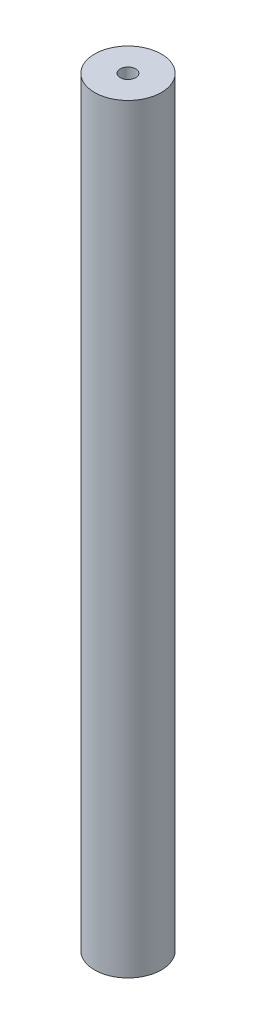
from build123d import *

# Parameters (mm, degrees)
SKETCH1_R           = 6.5
BOSS_EXTRUDE1_DEPTH = 148
SKETCH2_R           = 1.5
CUT_EXTRUDE1_DEPTH  = 5
LPATTERN1_COUNT     = 2
LPATTERN1_PITCH     = 143


with BuildPart() as part:
    # Sketch1 → Boss-Extrude1 (new body)
    with BuildSketch(Plane(origin=(0, 0, 0), x_dir=(1, 0, 0), z_dir=(0, 1, 0))):
        with Locations(Location((0, 0, 0), (0, 0, 270))):
            Circle(SKETCH1_R)
    extrude(amount=BOSS_EXTRUDE1_DEPTH)

    # Sketch2 → Cut-Extrude1 (cut)
    with BuildSketch(Plane(origin=(0, 148, 0), x_dir=(1, 0, 0), z_dir=(0, 1, 0))):
        with Locations(Location((0, 0, 0), (0, 0, 270))):
            Circle(SKETCH2_R)
    cut_extrude1 = extrude(amount=-CUT_EXTRUDE1_DEPTH, mode=Mode.SUBTRACT)

    # LPattern1: Cut-Extrude1 ×2
    with Locations(*[(0, -i * LPATTERN1_PITCH, 0) for i in range(1, LPATTERN1_COUNT)]):
        add(cut_extrude1, mode=Mode.SUBTRACT)


solid = part.part
